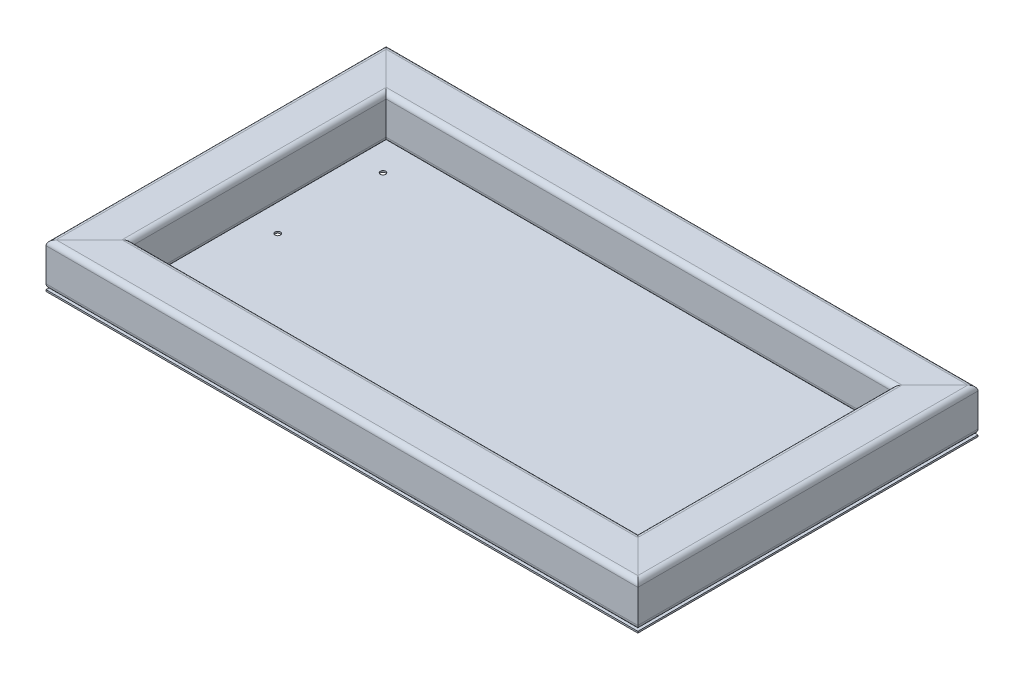
from build123d import *

# Parameters (mm, degrees)
TUBO_CUADRADO_2_X_2_X_0_25_1_DEPTH      = 473.442048969
TUBO_CUADRADO_2_X_2_X_0_25_1_DEPTH_BACK = 72.842048969
TUBO_CUADRADO_2_X_2_X_0_25_1_2_DEPTH    = 842.684097937
TUBO_CUADRADO_2_X_2_X_0_25_1_3_DEPTH    = 546.284097937
TUBO_CUADRADO_2_X_2_X_0_25_1_4_DEPTH    = 842.684097937
CROQUIS3_W                              = 697
CROQUIS3_H                              = 400.6
SALIENTE_EXTRUIR1_DEPTH                 = 1.9
CROQUIS4_R                              = 3.175
CORTAR_EXTRUIR1_DEPTH                   = 10


with BuildPart() as part:
    # Sketch1 → Tubo cuadrado 2 X 2 X 0.25(1) (new, two sides: drawn at the far end of the back side and taken through both)
    with BuildSketch(Plane(origin=(-323.1, 25.4, -200.3), x_dir=(1, 0, 0), z_dir=(0, 0, 1)).offset(-TUBO_CUADRADO_2_X_2_X_0_25_1_DEPTH_BACK)):
        with BuildLine():
            Line((-19.4, -25.4), (19.4, -25.4))
            ThreePointArc((19.4, -25.4), (23.642640687, -23.642640687), (25.4, -19.4))
            Line((25.4, -19.4), (25.4, 19.4))
            ThreePointArc((25.4, 19.4), (23.642640687, 23.642640687), (19.4, 25.4))
            Line((19.4, 25.4), (-19.4, 25.4))
            ThreePointArc((-19.4, 25.4), (-23.642640687, 23.642640687), (-25.4, 19.4))
            Line((-25.4, 19.4), (-25.4, -19.4))
            ThreePointArc((-25.4, -19.4), (-23.642640687, -23.642640687), (-19.4, -25.4))
        make_face()
        with BuildLine():
            Line((-19.4, -22.4), (19.4, -22.4))
            ThreePointArc((19.4, -22.4), (21.521320344, -21.521320344), (22.4, -19.4))
            Line((22.4, -19.4), (22.4, 19.4))
            ThreePointArc((22.4, 19.4), (21.521320344, 21.521320344), (19.4, 22.4))
            Line((19.4, 22.4), (-19.4, 22.4))
            ThreePointArc((-19.4, 22.4), (-21.521320344, 21.521320344), (-22.4, 19.4))
            Line((-22.4, 19.4), (-22.4, -19.4))
            ThreePointArc((-22.4, -19.4), (-21.521320344, -21.521320344), (-19.4, -22.4))
        make_face(mode=Mode.SUBTRACT)
    extrude(amount=TUBO_CUADRADO_2_X_2_X_0_25_1_DEPTH + TUBO_CUADRADO_2_X_2_X_0_25_1_DEPTH_BACK)

    # Tubo cuadrado 2 X 2 X 0.25(1) mitre 1
    split(bisect_by=Plane(origin=(-348.5, 0, -200.3), x_dir=(0, -1, 0), z_dir=(-0.707106781, 0, 0.707106781)), keep=Keep.TOP)

    # Tubo cuadrado 2 X 2 X 0.25(1) mitre 2
    split(bisect_by=Plane(origin=(-348.5, 0, 200.3), x_dir=(0, -1, 0), z_dir=(-0.707106781, 0, -0.707106781)), keep=Keep.TOP)


with BuildPart() as body_2:
    # Sketch1 on segment 2 (carried to segment 2) → Tubo cuadrado 2 X 2 X 0.25_1 2 (new body)
    with BuildSketch(Plane(origin=(-421.342048969, 25.4, 174.9), x_dir=(0, 0, -1), z_dir=(1, 0, 0))):
        with BuildLine():
            Line((-19.4, -25.4), (19.4, -25.4))
            ThreePointArc((19.4, -25.4), (23.642640687, -23.642640687), (25.4, -19.4))
            Line((25.4, -19.4), (25.4, 19.4))
            ThreePointArc((25.4, 19.4), (23.642640687, 23.642640687), (19.4, 25.4))
            Line((19.4, 25.4), (-19.4, 25.4))
            ThreePointArc((-19.4, 25.4), (-23.642640687, 23.642640687), (-25.4, 19.4))
            Line((-25.4, 19.4), (-25.4, -19.4))
            ThreePointArc((-25.4, -19.4), (-23.642640687, -23.642640687), (-19.4, -25.4))
        make_face()
        with BuildLine():
            Line((-19.4, -22.4), (19.4, -22.4))
            ThreePointArc((19.4, -22.4), (21.521320344, -21.521320344), (22.4, -19.4))
            Line((22.4, -19.4), (22.4, 19.4))
            ThreePointArc((22.4, 19.4), (21.521320344, 21.521320344), (19.4, 22.4))
            Line((19.4, 22.4), (-19.4, 22.4))
            ThreePointArc((-19.4, 22.4), (-21.521320344, 21.521320344), (-22.4, 19.4))
            Line((-22.4, 19.4), (-22.4, -19.4))
            ThreePointArc((-22.4, -19.4), (-21.521320344, -21.521320344), (-19.4, -22.4))
        make_face(mode=Mode.SUBTRACT)
    extrude(amount=TUBO_CUADRADO_2_X_2_X_0_25_1_2_DEPTH)

    # Tubo cuadrado 2 X 2 X 0.25_1 2 mitre 1
    split(bisect_by=Plane(origin=(-348.5, 0, 200.3), x_dir=(0, 1, 0), z_dir=(0.707106781, 0, 0.707106781)), keep=Keep.TOP)

    # Tubo cuadrado 2 X 2 X 0.25_1 2 mitre 2
    split(bisect_by=Plane(origin=(348.5, 0, 200.3), x_dir=(0, -1, 0), z_dir=(-0.707106781, 0, 0.707106781)), keep=Keep.TOP)


with BuildPart() as body_3:
    # Sketch1 on segment 3 (carried to segment 3) → Tubo cuadrado 2 X 2 X 0.25_1 3 (new body)
    with BuildSketch(Plane(origin=(323.1, 25.4, 273.142048969), x_dir=(-1, 0, 0), z_dir=(0, 0, -1))):
        with BuildLine():
            Line((-19.4, -25.4), (19.4, -25.4))
            ThreePointArc((19.4, -25.4), (23.642640687, -23.642640687), (25.4, -19.4))
            Line((25.4, -19.4), (25.4, 19.4))
            ThreePointArc((25.4, 19.4), (23.642640687, 23.642640687), (19.4, 25.4))
            Line((19.4, 25.4), (-19.4, 25.4))
            ThreePointArc((-19.4, 25.4), (-23.642640687, 23.642640687), (-25.4, 19.4))
            Line((-25.4, 19.4), (-25.4, -19.4))
            ThreePointArc((-25.4, -19.4), (-23.642640687, -23.642640687), (-19.4, -25.4))
        make_face()
        with BuildLine():
            Line((-19.4, -22.4), (19.4, -22.4))
            ThreePointArc((19.4, -22.4), (21.521320344, -21.521320344), (22.4, -19.4))
            Line((22.4, -19.4), (22.4, 19.4))
            ThreePointArc((22.4, 19.4), (21.521320344, 21.521320344), (19.4, 22.4))
            Line((19.4, 22.4), (-19.4, 22.4))
            ThreePointArc((-19.4, 22.4), (-21.521320344, 21.521320344), (-22.4, 19.4))
            Line((-22.4, 19.4), (-22.4, -19.4))
            ThreePointArc((-22.4, -19.4), (-21.521320344, -21.521320344), (-19.4, -22.4))
        make_face(mode=Mode.SUBTRACT)
    extrude(amount=TUBO_CUADRADO_2_X_2_X_0_25_1_3_DEPTH)

    # Tubo cuadrado 2 X 2 X 0.25_1 3 mitre 1
    split(bisect_by=Plane(origin=(348.5, 0, -200.3), x_dir=(0, 1, 0), z_dir=(0.707106781, 0, 0.707106781)), keep=Keep.TOP)

    # Tubo cuadrado 2 X 2 X 0.25_1 3 mitre 2
    split(bisect_by=Plane(origin=(348.5, 0, 200.3), x_dir=(0, 1, 0), z_dir=(0.707106781, 0, -0.707106781)), keep=Keep.TOP)


with BuildPart() as body_4:
    # Sketch1 on segment 4 (carried to segment 4) → Tubo cuadrado 2 X 2 X 0.25_1 4 (new body)
    with BuildSketch(Plane(origin=(421.342048969, 25.4, -174.9), x_dir=(0, 0, 1), z_dir=(-1, 0, 0))):
        with BuildLine():
            Line((-19.4, -25.4), (19.4, -25.4))
            ThreePointArc((19.4, -25.4), (23.642640687, -23.642640687), (25.4, -19.4))
            Line((25.4, -19.4), (25.4, 19.4))
            ThreePointArc((25.4, 19.4), (23.642640687, 23.642640687), (19.4, 25.4))
            Line((19.4, 25.4), (-19.4, 25.4))
            ThreePointArc((-19.4, 25.4), (-23.642640687, 23.642640687), (-25.4, 19.4))
            Line((-25.4, 19.4), (-25.4, -19.4))
            ThreePointArc((-25.4, -19.4), (-23.642640687, -23.642640687), (-19.4, -25.4))
        make_face()
        with BuildLine():
            Line((-19.4, -22.4), (19.4, -22.4))
            ThreePointArc((19.4, -22.4), (21.521320344, -21.521320344), (22.4, -19.4))
            Line((22.4, -19.4), (22.4, 19.4))
            ThreePointArc((22.4, 19.4), (21.521320344, 21.521320344), (19.4, 22.4))
            Line((19.4, 22.4), (-19.4, 22.4))
            ThreePointArc((-19.4, 22.4), (-21.521320344, 21.521320344), (-22.4, 19.4))
            Line((-22.4, 19.4), (-22.4, -19.4))
            ThreePointArc((-22.4, -19.4), (-21.521320344, -21.521320344), (-19.4, -22.4))
        make_face(mode=Mode.SUBTRACT)
    extrude(amount=TUBO_CUADRADO_2_X_2_X_0_25_1_4_DEPTH)

    # Tubo cuadrado 2 X 2 X 0.25_1 4 mitre 1
    split(bisect_by=Plane(origin=(-348.5, 0, -200.3), x_dir=(0, 1, 0), z_dir=(0.707106781, 0, -0.707106781)), keep=Keep.TOP)

    # Tubo cuadrado 2 X 2 X 0.25_1 4 mitre 2
    split(bisect_by=Plane(origin=(348.5, 0, -200.3), x_dir=(0, -1, 0), z_dir=(-0.707106781, 0, -0.707106781)), keep=Keep.TOP)


with BuildPart() as body_5:
    # Croquis3 → Saliente-Extruir1 (new body)
    with BuildSketch(Plane.XZ):
        Rectangle(CROQUIS3_W, CROQUIS3_H)
    extrude(amount=SALIENTE_EXTRUIR1_DEPTH)

    # Croquis4 → Cortar-Extruir1 (cut)
    with BuildSketch(Plane(origin=(0, 0, 0), x_dir=(1, 0, 0), z_dir=(0, 1, 0))):
        with Locations(Location((-269.2, 117.3, 0), (0, 0, 270))):
            Circle(CROQUIS4_R)
        with Locations(Location((-269.2, -6.7, 0), (0, 0, 270))):
            Circle(CROQUIS4_R)
        with Locations(Location((269.2, 117.3, 0), (0, 0, 270))):
            Circle(CROQUIS4_R)
        with Locations(Location((269.2, -6.7, 0), (0, 0, 270))):
            Circle(CROQUIS4_R)
    extrude(amount=-CORTAR_EXTRUIR1_DEPTH, mode=Mode.SUBTRACT)


solid = Compound([part.part, body_2.part, body_3.part, body_4.part, body_5.part])
